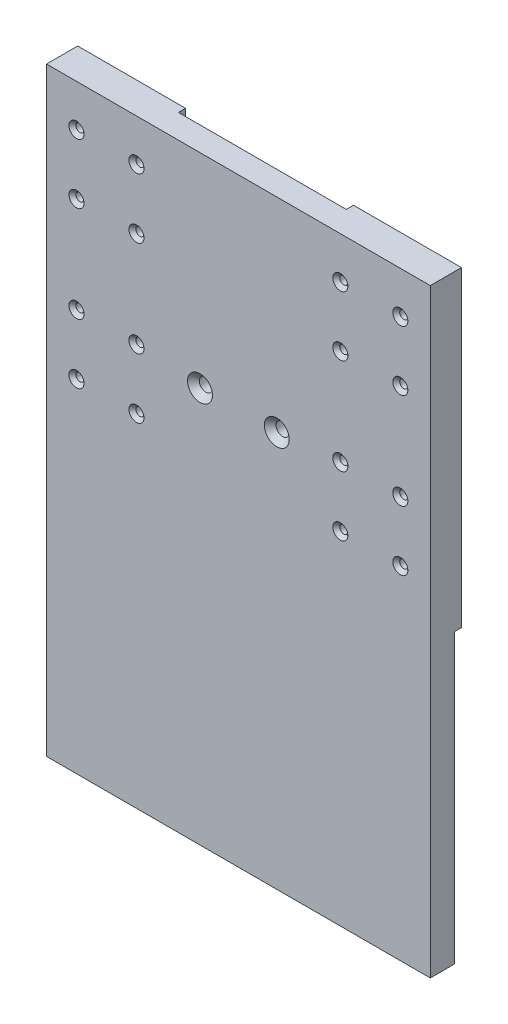
from build123d import *

# Parameters (mm, degrees)
SKETCH_1_W                 = 160
SKETCH_1_H                 = 250
EXTRUDE_271_DEPTH          = 10
SKETCH_6_W                 = 45
SKETCH_6_H                 = 130
EXTRUDE_648_DEPTH          = 3
HOLE_WIZARD_M3_D           = 3.4
HOLE_WIZARD_M3_CSINK_D     = 6.3
HOLE_WIZARD_M3_CSINK_ANGLE = 90
HOLE_WIZARD_M5_D           = 5.5
HOLE_WIZARD_M5_CSINK_D     = 10.4
HOLE_WIZARD_M5_CSINK_ANGLE = 90


with BuildPart() as part:
    # Эскиз1 → Extrude 271 (new body)
    with BuildSketch(Plane.XY):
        Rectangle(SKETCH_1_W, SKETCH_1_H)
    extrude(amount=EXTRUDE_271_DEPTH)

    # Эскиз6 → Extrude 648 (add)
    with BuildSketch(Plane(origin=(0, 0, 0), x_dir=(-1, 0, 0), z_dir=(0, 0, -1))):
        with Locations((-57.5, 60)):
            Rectangle(SKETCH_6_W, SKETCH_6_H)
        with Locations((57.5, 60)):
            Rectangle(SKETCH_6_W, SKETCH_6_H)
    extrude(amount=EXTRUDE_648_DEPTH)

    # Каретки-M3 (through all)
    with Locations(Plane.XY.offset(10)):
        with Locations((-67.5, 107.5), (-42.5, 107.5), (-42.5, 82.5), (-67.5, 82.5), (42.5, 107.5), (67.5, 107.5), (67.5, 82.5), (42.5, 82.5), (-67.5, 42.5), (-42.5, 42.5), (-42.5, 17.5), (-67.5, 17.5), (42.5, 42.5), (67.5, 42.5), (67.5, 17.5), (42.5, 17.5)):
            CounterSinkHole(HOLE_WIZARD_M3_D / 2, HOLE_WIZARD_M3_CSINK_D / 2, counter_sink_angle=HOLE_WIZARD_M3_CSINK_ANGLE)

    # Гайка ШВП - M5 (through all)
    with Locations(Plane.XY.offset(10)):
        with Locations((-16, 40), (16, 40)):
            CounterSinkHole(HOLE_WIZARD_M5_D / 2, HOLE_WIZARD_M5_CSINK_D / 2, counter_sink_angle=HOLE_WIZARD_M5_CSINK_ANGLE)


solid = part.part
